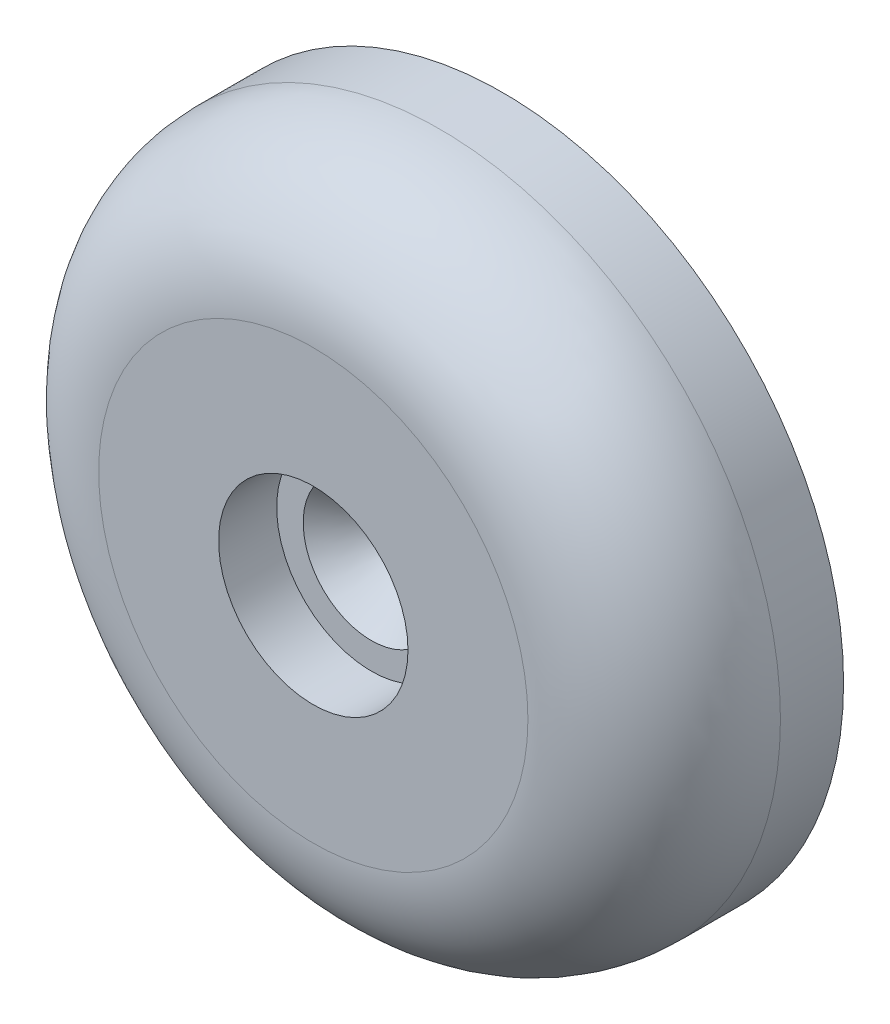
from build123d import *

# Parameters (mm, degrees)
SKETCH_2_R          = 27
EXTRUDE_1_DEPTH     = 15
FILLET_3_R          = 10
SHELL_2_T           = -2
SKETCH_5_R          = 9.5
EXTRUDE_2_DEPTH     = 13
SKETCH_6_R          = 2.4
CUT_EXTRUDE_1_DEPTH = 42.024382994
EXTRUDE_3_REACH     = 43.024
SKETCH_7_W          = 1.2
SKETCH_7_H          = 17
SKETCH_8_R          = 7.5
CUT_EXTRUDE_2_DEPTH = 4.6
CHAMFER_1_SIZE      = 3


with BuildPart() as part:
    # Эскиз2 → Бобышка-Вытянуть1 (new body)
    with BuildSketch(Plane.XY):
        Circle(SKETCH_2_R)
    extrude(amount=EXTRUDE_1_DEPTH)

    # Скругление3
    fillet_3_edges = [part.edges().sort_by_distance(p)[0] for p in [
        (-27, 0, 15),
    ]]
    fillet(fillet_3_edges, radius=FILLET_3_R)

    # Оболочка2
    shell_2_openings = [part.faces().sort_by_distance(p)[0] for p in [
        (0, 0, 0),
    ]]
    offset(amount=SHELL_2_T, openings=shell_2_openings, kind=Kind.INTERSECTION)

    # Эскиз5 → Бобышка-Вытянуть2 (add)
    with BuildSketch(Plane(origin=(0, 0, 13), x_dir=(-1, 0, 0), z_dir=(0, 0, -1))):
        with Locations(Location((0, 0, 0), (0, 0, 180))):
            Circle(SKETCH_5_R)
    extrude(amount=EXTRUDE_2_DEPTH)

    # Эскиз6 → Вырез-Вытянуть1 (cut, through all)
    with BuildSketch(Plane(origin=(0, 0, 0), x_dir=(-1, 0, 0), z_dir=(0, 0, -1))):
        Circle(SKETCH_6_R)
    extrude(amount=-CUT_EXTRUDE_1_DEPTH, mode=Mode.SUBTRACT)

    # Эскиз7 → Бобышка-Вытянуть3 (add, up to next)
    with BuildSketch(Plane(origin=(0, 0, 0), x_dir=(-1, 0, 0), z_dir=(0, 0, -1)), mode=Mode.PRIVATE) as extrude_3_sk1:
        with Locations((0, 17.5)):
            Rectangle(SKETCH_7_W, SKETCH_7_H)
    extrude_3_tool1 = extrude(extrude_3_sk1.sketch, amount=-EXTRUDE_3_REACH, mode=Mode.PRIVATE) - part.part
    # Эскиз7 → Бобышка-Вытянуть3 (add, up to next)
    with BuildSketch(Plane(origin=(0, 0, 0), x_dir=(-1, 0, 0), z_dir=(0, 0, -1)), mode=Mode.PRIVATE) as extrude_3_sk2:
        Polygon((7.494228634, 5.019615242), (22.216660498, 13.519615242), (22.816660498, 12.480384758), (8.094228634, 3.980384758), align=None)
    extrude_3_tool2 = extrude(extrude_3_sk2.sketch, amount=-EXTRUDE_3_REACH, mode=Mode.PRIVATE) - part.part
    # Эскиз7 → Бобышка-Вытянуть3 (add, up to next)
    with BuildSketch(Plane(origin=(0, 0, 0), x_dir=(-1, 0, 0), z_dir=(0, 0, -1)), mode=Mode.PRIVATE) as extrude_3_sk3:
        Polygon((8.094228634, -3.980384758), (22.816660498, -12.480384758), (22.216660498, -13.519615242), (7.494228634, -5.019615242), align=None)
    extrude_3_tool3 = extrude(extrude_3_sk3.sketch, amount=-EXTRUDE_3_REACH, mode=Mode.PRIVATE) - part.part
    # Эскиз7 → Бобышка-Вытянуть3 (add, up to next)
    with BuildSketch(Plane(origin=(0, 0, 0), x_dir=(-1, 0, 0), z_dir=(0, 0, -1)), mode=Mode.PRIVATE) as extrude_3_sk4:
        with Locations((0, -17.5)):
            Rectangle(SKETCH_7_W, SKETCH_7_H)
    extrude_3_tool4 = extrude(extrude_3_sk4.sketch, amount=-EXTRUDE_3_REACH, mode=Mode.PRIVATE) - part.part
    # Эскиз7 → Бобышка-Вытянуть3 (add, up to next)
    with BuildSketch(Plane(origin=(0, 0, 0), x_dir=(-1, 0, 0), z_dir=(0, 0, -1)), mode=Mode.PRIVATE) as extrude_3_sk5:
        Polygon((-7.494228634, -5.019615242), (-22.216660498, -13.519615242), (-22.816660498, -12.480384758), (-8.094228634, -3.980384758), align=None)
    extrude_3_tool5 = extrude(extrude_3_sk5.sketch, amount=-EXTRUDE_3_REACH, mode=Mode.PRIVATE) - part.part
    # Эскиз7 → Бобышка-Вытянуть3 (add, up to next)
    with BuildSketch(Plane(origin=(0, 0, 0), x_dir=(-1, 0, 0), z_dir=(0, 0, -1)), mode=Mode.PRIVATE) as extrude_3_sk6:
        Polygon((-8.094228634, 3.980384758), (-22.816660498, 12.480384758), (-22.216660498, 13.519615242), (-7.494228634, 5.019615242), align=None)
    extrude_3_tool6 = extrude(extrude_3_sk6.sketch, amount=-EXTRUDE_3_REACH, mode=Mode.PRIVATE) - part.part
    add(extrude_3_tool1.solids().sort_by_distance((0, 17.5, 0))[0])
    add(extrude_3_tool2.solids().sort_by_distance((-15.155445, 8.75, 0))[0])
    add(extrude_3_tool3.solids().sort_by_distance((-15.155445, -8.75, 0))[0])
    add(extrude_3_tool4.solids().sort_by_distance((0, -17.5, 0))[0])
    add(extrude_3_tool5.solids().sort_by_distance((15.155445, -8.75, 0))[0])
    add(extrude_3_tool6.solids().sort_by_distance((15.155445, 8.75, 0))[0])

    # Эскиз8 → Вырез-Вытянуть2 (cut)
    with BuildSketch(Plane.XY.offset(15)):
        Circle(SKETCH_8_R)
    extrude(amount=-CUT_EXTRUDE_2_DEPTH, mode=Mode.SUBTRACT)

    # Фаска1
    chamfer_1_edges = [part.edges().sort_by_distance(p)[0] for p in [
        (2.4, 0, 10.4),
    ]]
    chamfer(chamfer_1_edges, length=CHAMFER_1_SIZE)


solid = part.part
